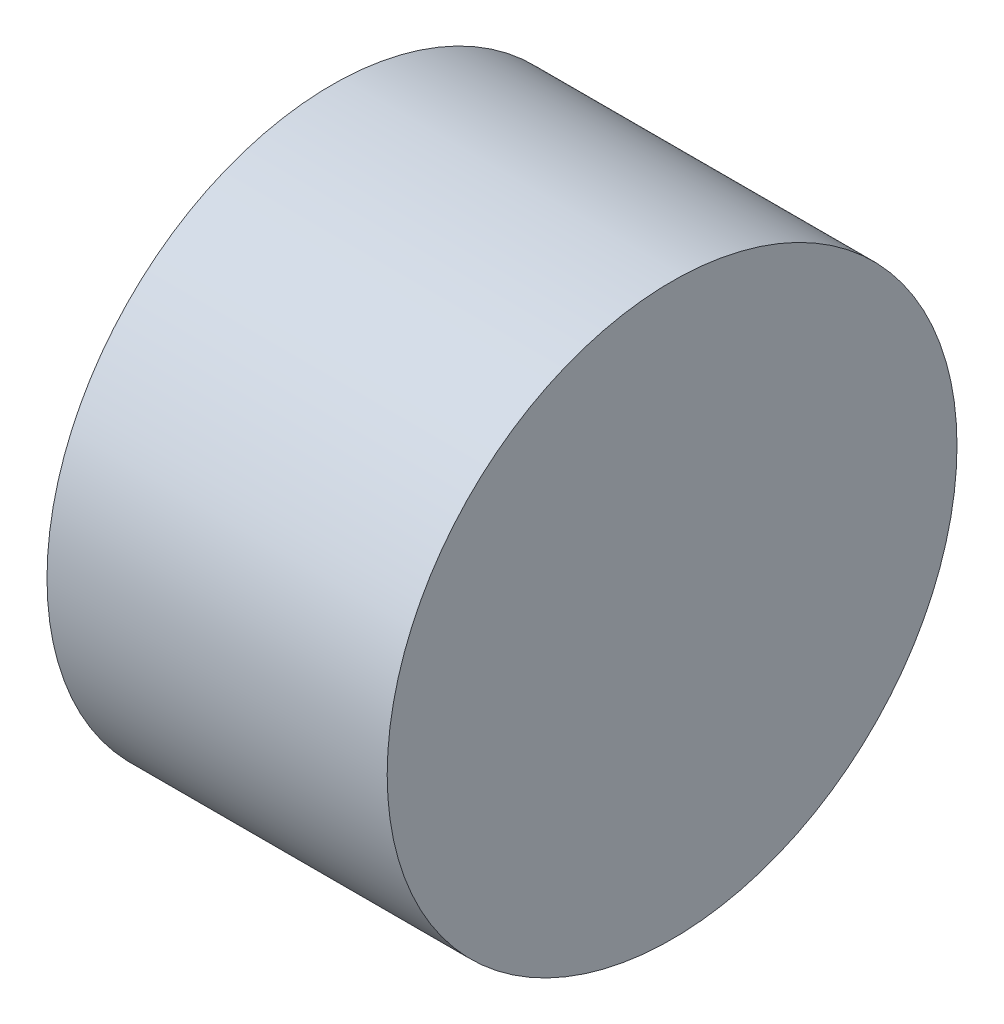
from build123d import *

# Parameters (mm, degrees)
SKETCH_1_R      = 33.5
EXTRUDE_1_DEPTH = 40


with BuildPart() as part:
    # 草图1 → 凸台-拉伸1 (new body)
    with BuildSketch(Plane(origin=(0, 0, 0), x_dir=(0, 0, -1), z_dir=(1, 0, 0))):
        Circle(SKETCH_1_R)
    extrude(amount=EXTRUDE_1_DEPTH)


solid = part.part
